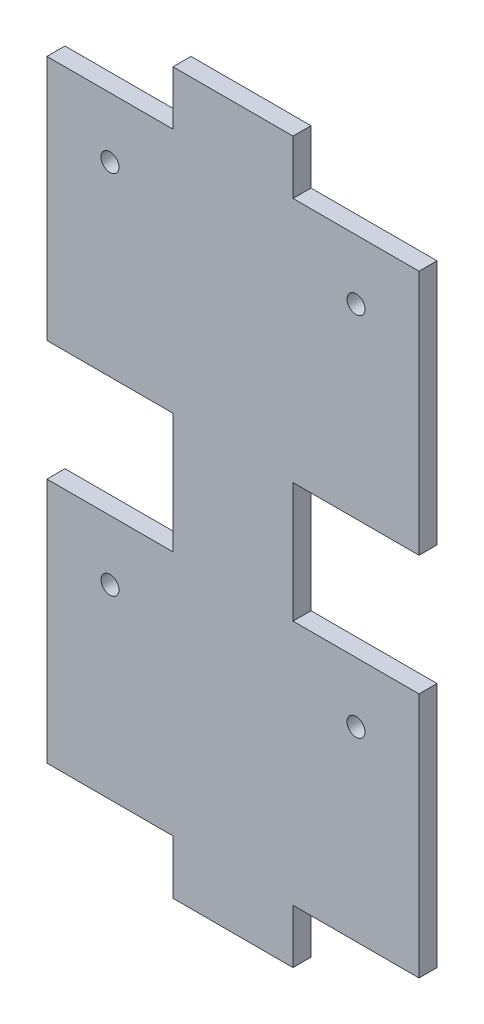
from build123d import *

# Parameters (mm, degrees)
CROQUIS2_R              = 1.5
SALIENTE_EXTRUIR1_DEPTH = 3


with BuildPart() as part:
    # Croquis2 → Saliente-Extruir1 (new body)
    with BuildSketch(Plane.XY):
        Polygon((-10, -56.591411495), (10, -56.591411495), (10, -47.591411495), (31, -47.591411495), (31, -6.591411495), (10, -6.591411495), (10, 13.408588505), (31, 13.408588505), (31, 54.408588505), (10, 54.408588505), (10, 63.408588505), (-10, 63.408588505), (-10, 54.408588505), (-31, 54.408588505), (-31, 13.408588505), (-10, 13.408588505), (-10, -6.591411495), (-31, -6.591411495), (-31, -47.591411495), (-10, -47.591411495), align=None)
        with Locations((-20.5, -16.591411495)):
            Circle(CROQUIS2_R, mode=Mode.SUBTRACT)
        with Locations((-20.5, 44.408588505)):
            Circle(CROQUIS2_R, mode=Mode.SUBTRACT)
        with Locations((20.5, 44.408588505)):
            Circle(CROQUIS2_R, mode=Mode.SUBTRACT)
        with Locations((20.5, -16.591411495)):
            Circle(CROQUIS2_R, mode=Mode.SUBTRACT)
    extrude(amount=SALIENTE_EXTRUIR1_DEPTH)


solid = part.part
